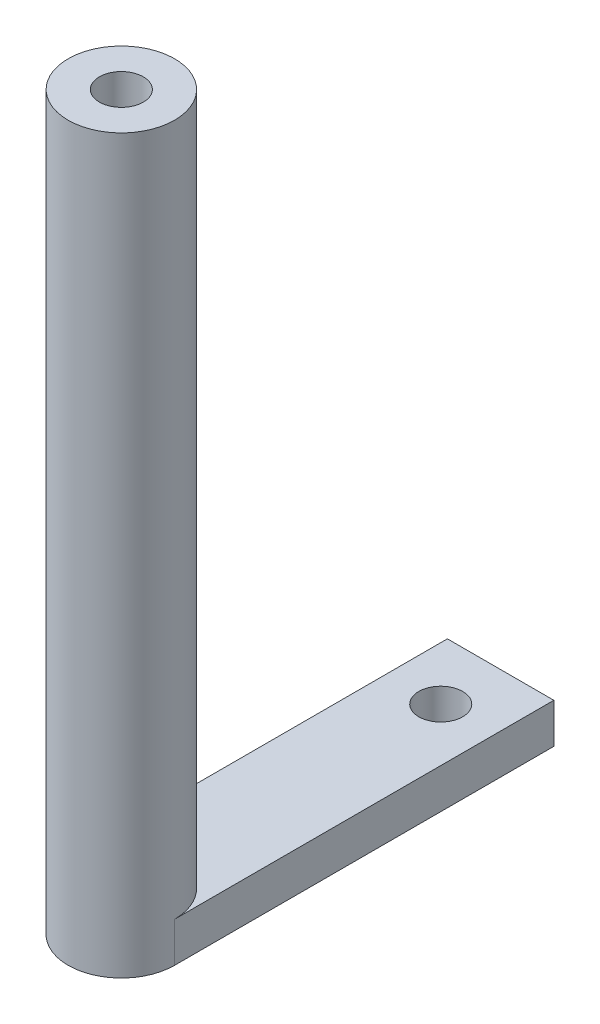
from build123d import *

# Parameters (mm, degrees)
SKIZZE2_R                       = 1.65
SKIZZE2_R_2                     = 4
AUFSATZ_LINEAR_AUSTRAGEN1_DEPTH = 3
SKIZZE3_R                       = 4
AUFSATZ_LINEAR_AUSTRAGEN2_DEPTH = 52
SKIZZE4_R                       = 1.65
SCHNITT_LINEAR_AUSTRAGEN1_DEPTH = 10


with BuildPart() as part:
    # Skizze2 → Aufsatz-Linear austragen1 (new body)
    # profile 1 of 2: a face of its own
    with BuildSketch(Plane(origin=(0, 0, 0), x_dir=(1, 0, 0), z_dir=(0, 1, 0))):
        with BuildLine():
            Line((-4, 28.5), (-4, 0))
            ThreePointArc((-4, 0), (0, 4), (4, 0))
            Line((4, 0), (4, 28.5))
            Line((4, 28.5), (-4, 28.5))
        make_face()
        with Locations(Location((0, 24, 0), (0, 0, 270))):
            Circle(SKIZZE2_R, mode=Mode.SUBTRACT)
    # profile 2 of 2: a face of its own
    with BuildSketch(Plane(origin=(0, 0, 0), x_dir=(1, 0, 0), z_dir=(0, 1, 0))):
        Circle(SKIZZE2_R_2)
    extrude(amount=AUFSATZ_LINEAR_AUSTRAGEN1_DEPTH)

    # Skizze3 → Aufsatz-Linear austragen2 (add)
    with BuildSketch(Plane(origin=(0, 3, 0), x_dir=(1, 0, 0), z_dir=(0, 1, 0))):
        Circle(SKIZZE3_R)
    extrude(amount=AUFSATZ_LINEAR_AUSTRAGEN2_DEPTH)

    # Skizze4 → Schnitt-Linear austragen1 (cut)
    with BuildSketch(Plane(origin=(0, 55, 0), x_dir=(1, 0, 0), z_dir=(0, 1, 0))):
        with Locations(Location((0, 0, 0), (0, 0, 270))):
            Circle(SKIZZE4_R)
    extrude(amount=-SCHNITT_LINEAR_AUSTRAGEN1_DEPTH, mode=Mode.SUBTRACT)


solid = part.part
